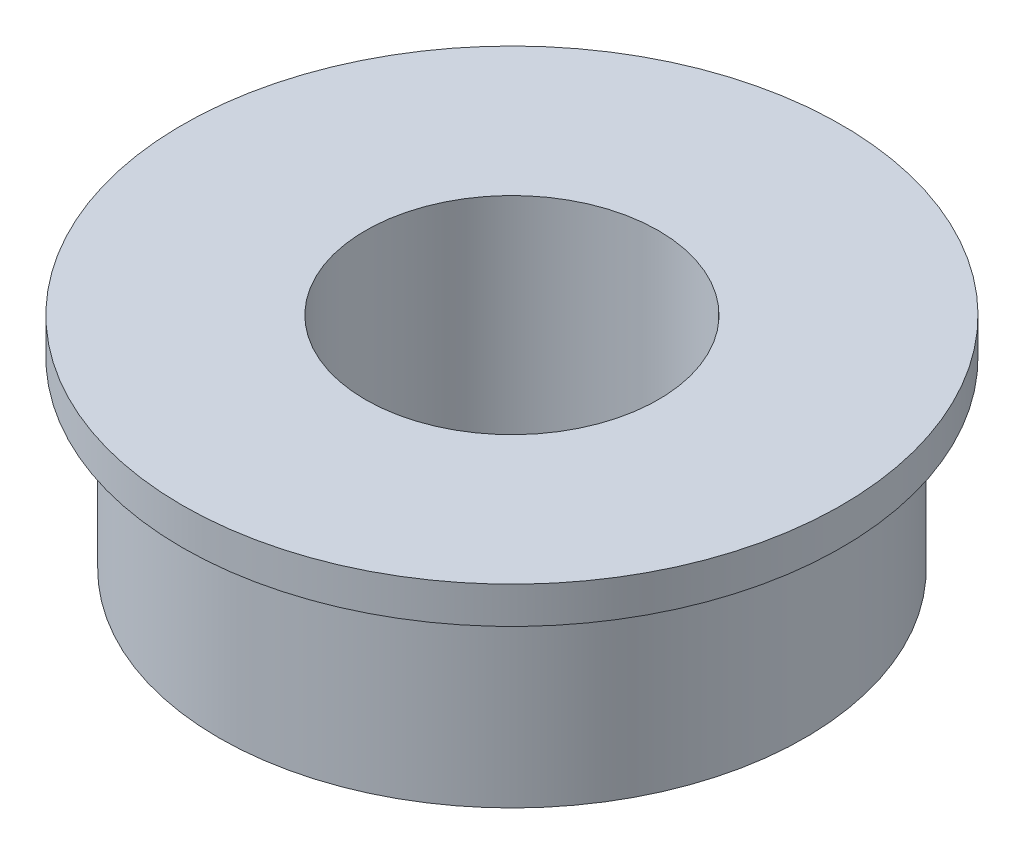
from build123d import *

# Parameters (mm, degrees)
SKETCH_1_R      = 4
SKETCH_1_R_2    = 2
EXTRUDE_1_DEPTH = 3
EXTRUDE_START   = -0.5
SKETCH_2_R      = 4.5
SKETCH_2_R_2    = 2
EXTRUDE_2_DEPTH = 0.5


with BuildPart() as part:
    # 草图1 → 凸台-拉伸1 (new body)
    with BuildSketch(Plane(origin=(0, 0, 0), x_dir=(1, 0, 0), z_dir=(0, 1, 0))):
        with Locations(Location((0, 0, 0), (0, 0, 270))):
            Circle(SKETCH_1_R)
        with Locations(Location((0, 0, 0), (0, 0, 270))):
            Circle(SKETCH_1_R_2, mode=Mode.SUBTRACT)
    extrude(amount=EXTRUDE_1_DEPTH)

    # 草图2 → 凸台-拉伸2 (add)
    with BuildSketch(Plane(origin=(0, 3, 0), x_dir=(1, 0, 0), z_dir=(0, 1, 0)).offset(EXTRUDE_START)):
        with Locations(Location((0, 0, 0), (0, 0, 270))):
            Circle(SKETCH_2_R)
        with Locations(Location((0, 0, 0), (0, 0, 270))):
            Circle(SKETCH_2_R_2, mode=Mode.SUBTRACT)
    extrude(amount=EXTRUDE_2_DEPTH)


solid = part.part
